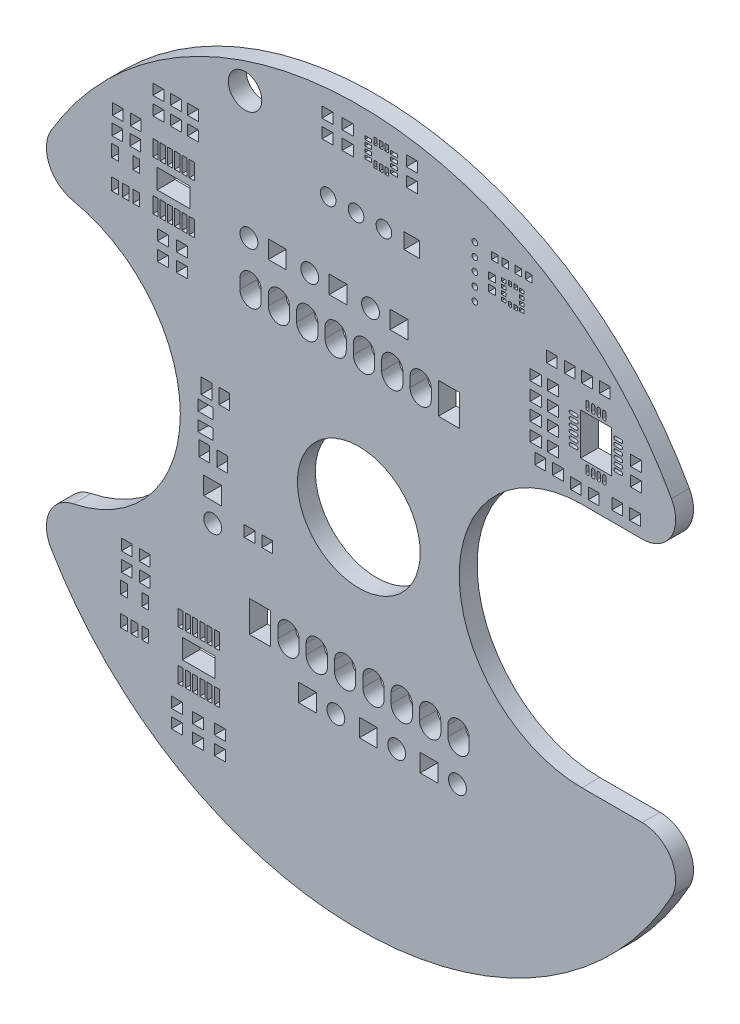
from build123d import *

# Parameters (mm, degrees)
MODEL_R            = 0.254
MODEL_R_2          = 1.5
MODEL_R_3          = 0.7
MODEL_R_4          = 0.8
MODEL_R_5          = 5.5
MODEL_W            = 0.4
MODEL_H            = 0.3
MODEL_W_2          = 0.3
MODEL_H_2          = 0.4
MODEL_W_3          = 0.59
MODEL_H_3          = 0.64
MODEL_W_4          = 0.64
MODEL_H_4          = 0.59
MODEL_W_5          = 0.95
MODEL_H_5          = 1.35
MODEL_W_6          = 1.35
MODEL_H_6          = 0.95
MODEL_W_7          = 0.6
MODEL_H_7          = 1.1
MODEL_W_8          = 0.45
MODEL_H_8          = 1.425
MODEL_W_9          = 2.947
MODEL_H_9          = 1.753
MODEL_W_10         = 1.905
MODEL_H_10         = 2.794
MODEL_H_11         = 0.6
MODEL_W_11         = 2.75
MODEL_H_12         = 3.75
MODEL_H_13         = 1
MODEL_W_12         = 1
MODEL_W_13         = 1.4
MODEL_H_14         = 1.4
MODEL_W_14         = 1.6
MODEL_H_15         = 1.6
BOSS_EXTRU_1_DEPTH = 1.6


with BuildPart() as part:
    # Model → Boss.-Extru.1 (new body)
    with BuildSketch(Plane.XY):
        with BuildLine():
            Line((25.396899903, -10.999993012), (19.999999903, -10.999993012))
            ThreePointArc((19.999999903, -10.999993012), (8.999999903, 6.988e-06), (19.999999903, 11.000006988))
            Line((19.999999903, 11.000006988), (25.396899903, 11.000006988))
            ThreePointArc((25.396899903, 11.000006988), (27.97996517, 12.474395332), (28.024096726, 15.448298418))
            ThreePointArc((28.024096726, 15.448298418), (0.442472559, 31.996936135), (-27.5862, 16.2173))
            ThreePointArc((-27.5862, 16.2173), (-27.740535183, 13.476382519), (-25.6, 11.7575))
            ThreePointArc((-25.6, 11.7575), (-15.999807577, -5e-05), (-25.6, -11.7576))
            ThreePointArc((-25.6, -11.7576), (-27.740471547, -13.476449402), (-27.5862, -16.2173))
            ThreePointArc((-27.5862, -16.2173), (0.442475694, -31.996932561), (28.024099903, -15.448293012))
            ThreePointArc((28.024099903, -15.448293012), (27.979973551, -12.474382167), (25.396899903, -10.999993012))
        make_face()
        with Locations((10.4, 21.95)):
            Circle(MODEL_R, mode=Mode.SUBTRACT)
        with Locations((10.4, 23.1)):
            Circle(MODEL_R, mode=Mode.SUBTRACT)
        with Locations((10.4, 24.25)):
            Circle(MODEL_R, mode=Mode.SUBTRACT)
        with Locations((10.4, 25.4)):
            Circle(MODEL_R, mode=Mode.SUBTRACT)
        with Locations((10.4, 26.55)):
            Circle(MODEL_R, mode=Mode.SUBTRACT)
        with Locations((-10.2, 28)):
            Circle(MODEL_R_2, mode=Mode.SUBTRACT)
        with Locations((2.25, 23.5)):
            Circle(MODEL_R_3, mode=Mode.SUBTRACT)
        with Locations((-0.25, 23.5)):
            Circle(MODEL_R_3, mode=Mode.SUBTRACT)
        with Locations((-2.75, 23.5)):
            Circle(MODEL_R_3, mode=Mode.SUBTRACT)
        with Locations((-9.85, 16.75)):
            Circle(MODEL_R_4, mode=Mode.SUBTRACT)
        with Locations((-4.4, 16.75)):
            Circle(MODEL_R_4, mode=Mode.SUBTRACT)
        with Locations((1.05, 16.75)):
            Circle(MODEL_R_4, mode=Mode.SUBTRACT)
        with Locations((8.84, -16.3)):
            Circle(MODEL_R_4, mode=Mode.SUBTRACT)
        with Locations((3.39, -16.3)):
            Circle(MODEL_R_4, mode=Mode.SUBTRACT)
        with Locations((-2.06, -16.3)):
            Circle(MODEL_R_4, mode=Mode.SUBTRACT)
        with Locations((-13.1, -7.02)):
            Circle(MODEL_R_4, mode=Mode.SUBTRACT)
        with Locations((6.088e-06, 3.579e-06)):
            Circle(MODEL_R_5, mode=Mode.SUBTRACT)
        with Locations((14.6, 23.35)):
            Rectangle(MODEL_W, MODEL_H, mode=Mode.SUBTRACT)
        with Locations((14.6, 23.85)):
            Rectangle(MODEL_W, MODEL_H, mode=Mode.SUBTRACT)
        with Locations((14.6, 24.35)):
            Rectangle(MODEL_W, MODEL_H, mode=Mode.SUBTRACT)
        with Locations((14.6, 24.85)):
            Rectangle(MODEL_W, MODEL_H, mode=Mode.SUBTRACT)
        with Locations((14.05, 24.9)):
            Rectangle(MODEL_W_2, MODEL_H_2, mode=Mode.SUBTRACT)
        with Locations((13.55, 24.9)):
            Rectangle(MODEL_W_2, MODEL_H_2, mode=Mode.SUBTRACT)
        with Locations((13, 24.85)):
            Rectangle(MODEL_W, MODEL_H, mode=Mode.SUBTRACT)
        with Locations((13, 24.35)):
            Rectangle(MODEL_W, MODEL_H, mode=Mode.SUBTRACT)
        with Locations((13, 23.85)):
            Rectangle(MODEL_W, MODEL_H, mode=Mode.SUBTRACT)
        with Locations((13, 23.35)):
            Rectangle(MODEL_W, MODEL_H, mode=Mode.SUBTRACT)
        with Locations((13.55, 23.3)):
            Rectangle(MODEL_W_2, MODEL_H_2, mode=Mode.SUBTRACT)
        with Locations((14.05, 23.3)):
            Rectangle(MODEL_W_2, MODEL_H_2, mode=Mode.SUBTRACT)
        with Locations((14.27, 26.25)):
            Rectangle(MODEL_W_3, MODEL_H_3, mode=Mode.SUBTRACT)
        with Locations((15.23, 26.25)):
            Rectangle(MODEL_W_3, MODEL_H_3, mode=Mode.SUBTRACT)
        with Locations((13.13, 26.25)):
            Rectangle(MODEL_W_3, MODEL_H_3, mode=Mode.SUBTRACT)
        with Locations((12.17, 26.25)):
            Rectangle(MODEL_W_3, MODEL_H_3, mode=Mode.SUBTRACT)
        with Locations((11.95, 24.58)):
            Rectangle(MODEL_W_4, MODEL_H_4, mode=Mode.SUBTRACT)
        with Locations((11.95, 23.62)):
            Rectangle(MODEL_W_4, MODEL_H_4, mode=Mode.SUBTRACT)
        with Locations((-12.25, -1.8)):
            Rectangle(MODEL_W_5, MODEL_H_5, mode=Mode.SUBTRACT)
        with Locations((-13.85, -1.8)):
            Rectangle(MODEL_W_5, MODEL_H_5, mode=Mode.SUBTRACT)
        with Locations((-12.05, 3.15)):
            Rectangle(MODEL_W_5, MODEL_H_5, mode=Mode.SUBTRACT)
        with Locations((-13.65, 3.15)):
            Rectangle(MODEL_W_5, MODEL_H_5, mode=Mode.SUBTRACT)
        with Locations((-13.75, -0.1)):
            Rectangle(MODEL_W_6, MODEL_H_6, mode=Mode.SUBTRACT)
        with Locations((-13.75, 1.5)):
            Rectangle(MODEL_W_6, MODEL_H_6, mode=Mode.SUBTRACT)
        with Locations((-21.85, 14.8)):
            Rectangle(MODEL_W_7, MODEL_H_7, mode=Mode.SUBTRACT)
        with Locations((-20.9, 14.8)):
            Rectangle(MODEL_W_7, MODEL_H_7, mode=Mode.SUBTRACT)
        with Locations((-19.95, 14.8)):
            Rectangle(MODEL_W_7, MODEL_H_7, mode=Mode.SUBTRACT)
        with Locations((-19.95, 17.4)):
            Rectangle(MODEL_W_7, MODEL_H_7, mode=Mode.SUBTRACT)
        with Locations((-21.85, 17.4)):
            Rectangle(MODEL_W_7, MODEL_H_7, mode=Mode.SUBTRACT)
        with Locations((-21.05, -18.7)):
            Rectangle(MODEL_W_7, MODEL_H_7, mode=Mode.SUBTRACT)
        with Locations((-20.1, -18.7)):
            Rectangle(MODEL_W_7, MODEL_H_7, mode=Mode.SUBTRACT)
        with Locations((-19.15, -18.7)):
            Rectangle(MODEL_W_7, MODEL_H_7, mode=Mode.SUBTRACT)
        with Locations((-19.15, -16.1)):
            Rectangle(MODEL_W_7, MODEL_H_7, mode=Mode.SUBTRACT)
        with Locations((-21.05, -16.1)):
            Rectangle(MODEL_W_7, MODEL_H_7, mode=Mode.SUBTRACT)
        with Locations((-18.225, 15.038)):
            Rectangle(MODEL_W_8, MODEL_H_8, mode=Mode.SUBTRACT)
        with Locations((-17.575, 15.038)):
            Rectangle(MODEL_W_8, MODEL_H_8, mode=Mode.SUBTRACT)
        with Locations((-16.925, 15.038)):
            Rectangle(MODEL_W_8, MODEL_H_8, mode=Mode.SUBTRACT)
        with Locations((-16.275, 15.038)):
            Rectangle(MODEL_W_8, MODEL_H_8, mode=Mode.SUBTRACT)
        with Locations((-15.625, 15.038)):
            Rectangle(MODEL_W_8, MODEL_H_8, mode=Mode.SUBTRACT)
        with Locations((-14.975, 15.038)):
            Rectangle(MODEL_W_8, MODEL_H_8, mode=Mode.SUBTRACT)
        with Locations((-14.975, 19.462)):
            Rectangle(MODEL_W_8, MODEL_H_8, mode=Mode.SUBTRACT)
        with Locations((-15.625, 19.462)):
            Rectangle(MODEL_W_8, MODEL_H_8, mode=Mode.SUBTRACT)
        with Locations((-16.275, 19.462)):
            Rectangle(MODEL_W_8, MODEL_H_8, mode=Mode.SUBTRACT)
        with Locations((-16.925, 19.462)):
            Rectangle(MODEL_W_8, MODEL_H_8, mode=Mode.SUBTRACT)
        with Locations((-17.575, 19.462)):
            Rectangle(MODEL_W_8, MODEL_H_8, mode=Mode.SUBTRACT)
        with Locations((-18.225, 19.462)):
            Rectangle(MODEL_W_8, MODEL_H_8, mode=Mode.SUBTRACT)
        with Locations((-16.6, 17.25)):
            Rectangle(MODEL_W_9, MODEL_H_9, mode=Mode.SUBTRACT)
        with Locations((-12.725, -15.888)):
            Rectangle(MODEL_W_8, MODEL_H_8, mode=Mode.SUBTRACT)
        with Locations((-13.375, -15.888)):
            Rectangle(MODEL_W_8, MODEL_H_8, mode=Mode.SUBTRACT)
        with Locations((-14.025, -15.888)):
            Rectangle(MODEL_W_8, MODEL_H_8, mode=Mode.SUBTRACT)
        with Locations((-14.675, -15.888)):
            Rectangle(MODEL_W_8, MODEL_H_8, mode=Mode.SUBTRACT)
        with Locations((-15.325, -15.888)):
            Rectangle(MODEL_W_8, MODEL_H_8, mode=Mode.SUBTRACT)
        with Locations((-15.975, -15.888)):
            Rectangle(MODEL_W_8, MODEL_H_8, mode=Mode.SUBTRACT)
        with Locations((-15.975, -20.312)):
            Rectangle(MODEL_W_8, MODEL_H_8, mode=Mode.SUBTRACT)
        with Locations((-15.325, -20.312)):
            Rectangle(MODEL_W_8, MODEL_H_8, mode=Mode.SUBTRACT)
        with Locations((-14.675, -20.312)):
            Rectangle(MODEL_W_8, MODEL_H_8, mode=Mode.SUBTRACT)
        with Locations((-14.025, -20.312)):
            Rectangle(MODEL_W_8, MODEL_H_8, mode=Mode.SUBTRACT)
        with Locations((-13.375, -20.312)):
            Rectangle(MODEL_W_8, MODEL_H_8, mode=Mode.SUBTRACT)
        with Locations((-12.725, -20.312)):
            Rectangle(MODEL_W_8, MODEL_H_8, mode=Mode.SUBTRACT)
        with Locations((-14.35, -18.1)):
            Rectangle(MODEL_W_9, MODEL_H_9, mode=Mode.SUBTRACT)
        with Locations((8.08, 12.8)):
            Rectangle(MODEL_W_10, MODEL_H_10, mode=Mode.SUBTRACT)
        with BuildLine():
            Line((4.5875, 12.3555), (4.5875, 13.2445))
            ThreePointArc((4.5875, 13.2445), (5.54, 14.197), (6.4925, 13.2445))
            Line((6.4925, 13.2445), (6.4925, 12.3555))
            ThreePointArc((6.4925, 12.3555), (5.54, 11.403), (4.5875, 12.3555))
        make_face(mode=Mode.SUBTRACT)
        with BuildLine():
            Line((2.0475, 12.3555), (2.0475, 13.2445))
            ThreePointArc((2.0475, 13.2445), (3, 14.197), (3.9525, 13.2445))
            Line((3.9525, 13.2445), (3.9525, 12.3555))
            ThreePointArc((3.9525, 12.3555), (3, 11.403), (2.0475, 12.3555))
        make_face(mode=Mode.SUBTRACT)
        with BuildLine():
            Line((-0.4925, 12.3555), (-0.4925, 13.2445))
            ThreePointArc((-0.4925, 13.2445), (0.46, 14.197), (1.4125, 13.2445))
            Line((1.4125, 13.2445), (1.4125, 12.3555))
            ThreePointArc((1.4125, 12.3555), (0.46, 11.403), (-0.4925, 12.3555))
        make_face(mode=Mode.SUBTRACT)
        with BuildLine():
            Line((-3.0325, 12.3555), (-3.0325, 13.2445))
            ThreePointArc((-3.0325, 13.2445), (-2.08, 14.197), (-1.1275, 13.2445))
            Line((-1.1275, 13.2445), (-1.1275, 12.3555))
            ThreePointArc((-1.1275, 12.3555), (-2.08, 11.403), (-3.0325, 12.3555))
        make_face(mode=Mode.SUBTRACT)
        with BuildLine():
            Line((-5.5725, 12.3555), (-5.5725, 13.2445))
            ThreePointArc((-5.5725, 13.2445), (-4.62, 14.197), (-3.6675, 13.2445))
            Line((-3.6675, 13.2445), (-3.6675, 12.3555))
            ThreePointArc((-3.6675, 12.3555), (-4.62, 11.403), (-5.5725, 12.3555))
        make_face(mode=Mode.SUBTRACT)
        with BuildLine():
            Line((-8.1125, 12.3555), (-8.1125, 13.2445))
            ThreePointArc((-8.1125, 13.2445), (-7.16, 14.197), (-6.2075, 13.2445))
            Line((-6.2075, 13.2445), (-6.2075, 12.3555))
            ThreePointArc((-6.2075, 12.3555), (-7.16, 11.403), (-8.1125, 12.3555))
        make_face(mode=Mode.SUBTRACT)
        with BuildLine():
            Line((-10.6525, 12.3555), (-10.6525, 13.2445))
            ThreePointArc((-10.6525, 13.2445), (-9.7, 14.197), (-8.7475, 13.2445))
            Line((-8.7475, 13.2445), (-8.7475, 12.3555))
            ThreePointArc((-8.7475, 12.3555), (-9.7, 11.403), (-10.6525, 12.3555))
        make_face(mode=Mode.SUBTRACT)
        with Locations((-8.85, -12.6)):
            Rectangle(MODEL_W_10, MODEL_H_10, mode=Mode.SUBTRACT)
        with BuildLine():
            Line((-5.3575, -12.1555), (-5.3575, -13.0445))
            ThreePointArc((-5.3575, -13.0445), (-6.31, -13.997), (-7.2625, -13.0445))
            Line((-7.2625, -13.0445), (-7.2625, -12.1555))
            ThreePointArc((-7.2625, -12.1555), (-6.31, -11.203), (-5.3575, -12.1555))
        make_face(mode=Mode.SUBTRACT)
        with BuildLine():
            Line((-2.8175, -12.1555), (-2.8175, -13.0445))
            ThreePointArc((-2.8175, -13.0445), (-3.77, -13.997), (-4.7225, -13.0445))
            Line((-4.7225, -13.0445), (-4.7225, -12.1555))
            ThreePointArc((-4.7225, -12.1555), (-3.77, -11.203), (-2.8175, -12.1555))
        make_face(mode=Mode.SUBTRACT)
        with BuildLine():
            Line((-0.2775, -12.1555), (-0.2775, -13.0445))
            ThreePointArc((-0.2775, -13.0445), (-1.23, -13.997), (-2.1825, -13.0445))
            Line((-2.1825, -13.0445), (-2.1825, -12.1555))
            ThreePointArc((-2.1825, -12.1555), (-1.23, -11.203), (-0.2775, -12.1555))
        make_face(mode=Mode.SUBTRACT)
        with BuildLine():
            Line((2.2625, -12.1555), (2.2625, -13.0445))
            ThreePointArc((2.2625, -13.0445), (1.31, -13.997), (0.3575, -13.0445))
            Line((0.3575, -13.0445), (0.3575, -12.1555))
            ThreePointArc((0.3575, -12.1555), (1.31, -11.203), (2.2625, -12.1555))
        make_face(mode=Mode.SUBTRACT)
        with BuildLine():
            Line((4.8025, -12.1555), (4.8025, -13.0445))
            ThreePointArc((4.8025, -13.0445), (3.85, -13.997), (2.8975, -13.0445))
            Line((2.8975, -13.0445), (2.8975, -12.1555))
            ThreePointArc((2.8975, -12.1555), (3.85, -11.203), (4.8025, -12.1555))
        make_face(mode=Mode.SUBTRACT)
        with BuildLine():
            Line((7.3425, -12.1555), (7.3425, -13.0445))
            ThreePointArc((7.3425, -13.0445), (6.39, -13.997), (5.4375, -13.0445))
            Line((5.4375, -13.0445), (5.4375, -12.1555))
            ThreePointArc((5.4375, -12.1555), (6.39, -11.203), (7.3425, -12.1555))
        make_face(mode=Mode.SUBTRACT)
        with BuildLine():
            Line((9.8825, -12.1555), (9.8825, -13.0445))
            ThreePointArc((9.8825, -13.0445), (8.93, -13.997), (7.9775, -13.0445))
            Line((7.9775, -13.0445), (7.9775, -12.1555))
            ThreePointArc((7.9775, -12.1555), (8.93, -11.203), (9.8825, -12.1555))
        make_face(mode=Mode.SUBTRACT)
        with Locations((3.15, 28.25)):
            Rectangle(MODEL_W_7, MODEL_H, mode=Mode.SUBTRACT)
        with Locations((3.15, 28.75)):
            Rectangle(MODEL_W_7, MODEL_H, mode=Mode.SUBTRACT)
        with Locations((3.15, 29.25)):
            Rectangle(MODEL_W_7, MODEL_H, mode=Mode.SUBTRACT)
        with Locations((3.15, 29.75)):
            Rectangle(MODEL_W_7, MODEL_H, mode=Mode.SUBTRACT)
        with Locations((2.5, 29.9)):
            Rectangle(MODEL_W_2, MODEL_H_11, mode=Mode.SUBTRACT)
        with Locations((2, 29.9)):
            Rectangle(MODEL_W_2, MODEL_H_11, mode=Mode.SUBTRACT)
        with Locations((1.5, 29.9)):
            Rectangle(MODEL_W_2, MODEL_H_11, mode=Mode.SUBTRACT)
        with Locations((0.85, 29.75)):
            Rectangle(MODEL_W_7, MODEL_H, mode=Mode.SUBTRACT)
        with Locations((0.85, 29.25)):
            Rectangle(MODEL_W_7, MODEL_H, mode=Mode.SUBTRACT)
        with Locations((0.85, 28.75)):
            Rectangle(MODEL_W_7, MODEL_H, mode=Mode.SUBTRACT)
        with Locations((0.85, 28.25)):
            Rectangle(MODEL_W_7, MODEL_H, mode=Mode.SUBTRACT)
        with Locations((1.5, 28.1)):
            Rectangle(MODEL_W_2, MODEL_H_11, mode=Mode.SUBTRACT)
        with Locations((2, 28.1)):
            Rectangle(MODEL_W_2, MODEL_H_11, mode=Mode.SUBTRACT)
        with Locations((2.5, 28.1)):
            Rectangle(MODEL_W_2, MODEL_H_11, mode=Mode.SUBTRACT)
        with BuildLine():
            Line((23, 15.3), (23.5, 15.3))
            ThreePointArc((23.5, 15.3), (23.65, 15.15), (23.5, 15))
            Line((23.5, 15), (23, 15))
            ThreePointArc((23, 15), (22.85, 15.15), (23, 15.3))
        make_face(mode=Mode.SUBTRACT)
        with BuildLine():
            Line((23, 15.8), (23.5, 15.8))
            ThreePointArc((23.5, 15.8), (23.65, 15.65), (23.5, 15.5))
            Line((23.5, 15.5), (23, 15.5))
            ThreePointArc((23, 15.5), (22.85, 15.65), (23, 15.8))
        make_face(mode=Mode.SUBTRACT)
        with BuildLine():
            Line((23, 16.3), (23.5, 16.3))
            ThreePointArc((23.5, 16.3), (23.65, 16.15), (23.5, 16))
            Line((23.5, 16), (23, 16))
            ThreePointArc((23, 16), (22.85, 16.15), (23, 16.3))
        make_face(mode=Mode.SUBTRACT)
        with BuildLine():
            Line((23, 16.8), (23.5, 16.8))
            ThreePointArc((23.5, 16.8), (23.65, 16.65), (23.5, 16.5))
            Line((23.5, 16.5), (23, 16.5))
            ThreePointArc((23, 16.5), (22.85, 16.65), (23, 16.8))
        make_face(mode=Mode.SUBTRACT)
        with BuildLine():
            Line((23, 17.3), (23.5, 17.3))
            ThreePointArc((23.5, 17.3), (23.65, 17.15), (23.5, 17))
            Line((23.5, 17), (23, 17))
            ThreePointArc((23, 17), (22.85, 17.15), (23, 17.3))
        make_face(mode=Mode.SUBTRACT)
        with BuildLine():
            Line((23, 17.8), (23.5, 17.8))
            ThreePointArc((23.5, 17.8), (23.65, 17.65), (23.5, 17.5))
            Line((23.5, 17.5), (23, 17.5))
            ThreePointArc((23, 17.5), (22.85, 17.65), (23, 17.8))
        make_face(mode=Mode.SUBTRACT)
        with BuildLine():
            Line((21.85, 18.65), (21.85, 19.15))
            ThreePointArc((21.85, 19.15), (22, 19.3), (22.15, 19.15))
            Line((22.15, 19.15), (22.15, 18.65))
            ThreePointArc((22.15, 18.65), (22, 18.5), (21.85, 18.65))
        make_face(mode=Mode.SUBTRACT)
        with BuildLine():
            Line((21.35, 18.65), (21.35, 19.15))
            ThreePointArc((21.35, 19.15), (21.5, 19.3), (21.65, 19.15))
            Line((21.65, 19.15), (21.65, 18.65))
            ThreePointArc((21.65, 18.65), (21.5, 18.5), (21.35, 18.65))
        make_face(mode=Mode.SUBTRACT)
        with BuildLine():
            Line((20.85, 18.65), (20.85, 19.15))
            ThreePointArc((20.85, 19.15), (21, 19.3), (21.15, 19.15))
            Line((21.15, 19.15), (21.15, 18.65))
            ThreePointArc((21.15, 18.65), (21, 18.5), (20.85, 18.65))
        make_face(mode=Mode.SUBTRACT)
        with BuildLine():
            Line((20.35, 18.65), (20.35, 19.15))
            ThreePointArc((20.35, 19.15), (20.5, 19.3), (20.65, 19.15))
            Line((20.65, 19.15), (20.65, 18.65))
            ThreePointArc((20.65, 18.65), (20.5, 18.5), (20.35, 18.65))
        make_face(mode=Mode.SUBTRACT)
        with BuildLine():
            Line((19, 17.8), (19.5, 17.8))
            ThreePointArc((19.5, 17.8), (19.65, 17.65), (19.5, 17.5))
            Line((19.5, 17.5), (19, 17.5))
            ThreePointArc((19, 17.5), (18.85, 17.65), (19, 17.8))
        make_face(mode=Mode.SUBTRACT)
        with BuildLine():
            Line((19, 17.3), (19.5, 17.3))
            ThreePointArc((19.5, 17.3), (19.65, 17.15), (19.5, 17))
            Line((19.5, 17), (19, 17))
            ThreePointArc((19, 17), (18.85, 17.15), (19, 17.3))
        make_face(mode=Mode.SUBTRACT)
        with BuildLine():
            Line((19, 16.8), (19.5, 16.8))
            ThreePointArc((19.5, 16.8), (19.65, 16.65), (19.5, 16.5))
            Line((19.5, 16.5), (19, 16.5))
            ThreePointArc((19, 16.5), (18.85, 16.65), (19, 16.8))
        make_face(mode=Mode.SUBTRACT)
        with BuildLine():
            Line((19, 16.3), (19.5, 16.3))
            ThreePointArc((19.5, 16.3), (19.65, 16.15), (19.5, 16))
            Line((19.5, 16), (19, 16))
            ThreePointArc((19, 16), (18.85, 16.15), (19, 16.3))
        make_face(mode=Mode.SUBTRACT)
        with BuildLine():
            Line((19, 15.8), (19.5, 15.8))
            ThreePointArc((19.5, 15.8), (19.65, 15.65), (19.5, 15.5))
            Line((19.5, 15.5), (19, 15.5))
            ThreePointArc((19, 15.5), (18.85, 15.65), (19, 15.8))
        make_face(mode=Mode.SUBTRACT)
        with BuildLine():
            Line((19, 15.3), (19.5, 15.3))
            ThreePointArc((19.5, 15.3), (19.65, 15.15), (19.5, 15))
            Line((19.5, 15), (19, 15))
            ThreePointArc((19, 15), (18.85, 15.15), (19, 15.3))
        make_face(mode=Mode.SUBTRACT)
        with BuildLine():
            Line((20.35, 13.65), (20.35, 14.15))
            ThreePointArc((20.35, 14.15), (20.5, 14.3), (20.65, 14.15))
            Line((20.65, 14.15), (20.65, 13.65))
            ThreePointArc((20.65, 13.65), (20.5, 13.5), (20.35, 13.65))
        make_face(mode=Mode.SUBTRACT)
        with BuildLine():
            Line((20.85, 13.65), (20.85, 14.15))
            ThreePointArc((20.85, 14.15), (21, 14.3), (21.15, 14.15))
            Line((21.15, 14.15), (21.15, 13.65))
            ThreePointArc((21.15, 13.65), (21, 13.5), (20.85, 13.65))
        make_face(mode=Mode.SUBTRACT)
        with BuildLine():
            Line((21.35, 13.65), (21.35, 14.15))
            ThreePointArc((21.35, 14.15), (21.5, 14.3), (21.65, 14.15))
            Line((21.65, 14.15), (21.65, 13.65))
            ThreePointArc((21.65, 13.65), (21.5, 13.5), (21.35, 13.65))
        make_face(mode=Mode.SUBTRACT)
        with BuildLine():
            Line((21.85, 13.65), (21.85, 14.15))
            ThreePointArc((21.85, 14.15), (22, 14.3), (22.15, 14.15))
            Line((22.15, 14.15), (22.15, 13.65))
            ThreePointArc((22.15, 13.65), (22, 13.5), (21.85, 13.65))
        make_face(mode=Mode.SUBTRACT)
        with Locations((21.25, 16.4)):
            Rectangle(MODEL_W_11, MODEL_H_12, mode=Mode.SUBTRACT)
        with Locations((-9.8, -6.2)):
            Rectangle(MODEL_W_5, MODEL_H_13, mode=Mode.SUBTRACT)
        with Locations((-8.2, -6.2)):
            Rectangle(MODEL_W_5, MODEL_H_13, mode=Mode.SUBTRACT)
        with Locations((-21.6, 20.65)):
            Rectangle(MODEL_W_5, MODEL_H_13, mode=Mode.SUBTRACT)
        with Locations((-20, 20.65)):
            Rectangle(MODEL_W_5, MODEL_H_13, mode=Mode.SUBTRACT)
        with Locations((-20.8, -12.75)):
            Rectangle(MODEL_W_5, MODEL_H_13, mode=Mode.SUBTRACT)
        with Locations((-19.2, -12.75)):
            Rectangle(MODEL_W_5, MODEL_H_13, mode=Mode.SUBTRACT)
        with Locations((-21.65, 19.05)):
            Rectangle(MODEL_W_5, MODEL_H_13, mode=Mode.SUBTRACT)
        with Locations((-20.05, 19.05)):
            Rectangle(MODEL_W_5, MODEL_H_13, mode=Mode.SUBTRACT)
        with Locations((-20.8, -14.4)):
            Rectangle(MODEL_W_5, MODEL_H_13, mode=Mode.SUBTRACT)
        with Locations((-19.2, -14.4)):
            Rectangle(MODEL_W_5, MODEL_H_13, mode=Mode.SUBTRACT)
        with Locations((-17.95, 24)):
            Rectangle(MODEL_W_12, MODEL_H_6, mode=Mode.SUBTRACT)
        with Locations((-17.95, 22.4)):
            Rectangle(MODEL_W_12, MODEL_H_6, mode=Mode.SUBTRACT)
        with Locations((20.45, 20.9)):
            Rectangle(MODEL_W_5, MODEL_H_13, mode=Mode.SUBTRACT)
        with Locations((22.05, 20.9)):
            Rectangle(MODEL_W_5, MODEL_H_13, mode=Mode.SUBTRACT)
        with Locations((-16.4, 22.4)):
            Rectangle(MODEL_W_12, MODEL_H_6, mode=Mode.SUBTRACT)
        with Locations((-16.4, 24)):
            Rectangle(MODEL_W_12, MODEL_H_6, mode=Mode.SUBTRACT)
        with Locations((-14.4, -23)):
            Rectangle(MODEL_W_12, MODEL_H_6, mode=Mode.SUBTRACT)
        with Locations((-14.4, -24.6)):
            Rectangle(MODEL_W_12, MODEL_H_6, mode=Mode.SUBTRACT)
        with Locations((-17.55, 12.9)):
            Rectangle(MODEL_W_12, MODEL_H_6, mode=Mode.SUBTRACT)
        with Locations((-17.55, 11.3)):
            Rectangle(MODEL_W_12, MODEL_H_6, mode=Mode.SUBTRACT)
        with Locations((-15.85, 11.3)):
            Rectangle(MODEL_W_12, MODEL_H_6, mode=Mode.SUBTRACT)
        with Locations((-15.85, 12.9)):
            Rectangle(MODEL_W_12, MODEL_H_6, mode=Mode.SUBTRACT)
        with Locations((-14.85, 24)):
            Rectangle(MODEL_W_12, MODEL_H_6, mode=Mode.SUBTRACT)
        with Locations((-14.85, 22.4)):
            Rectangle(MODEL_W_12, MODEL_H_6, mode=Mode.SUBTRACT)
        with Locations((4.75, 29.8)):
            Rectangle(MODEL_W_12, MODEL_H_6, mode=Mode.SUBTRACT)
        with Locations((4.75, 28.2)):
            Rectangle(MODEL_W_12, MODEL_H_6, mode=Mode.SUBTRACT)
        with Locations((-2.8, 28.2)):
            Rectangle(MODEL_W_12, MODEL_H_6, mode=Mode.SUBTRACT)
        with Locations((-2.8, 29.8)):
            Rectangle(MODEL_W_12, MODEL_H_6, mode=Mode.SUBTRACT)
        with Locations((-1, 28.2)):
            Rectangle(MODEL_W_12, MODEL_H_6, mode=Mode.SUBTRACT)
        with Locations((-1, 29.8)):
            Rectangle(MODEL_W_12, MODEL_H_6, mode=Mode.SUBTRACT)
        with Locations((16.25, 12.45)):
            Rectangle(MODEL_W_5, MODEL_H_13, mode=Mode.SUBTRACT)
        with Locations((17.85, 12.45)):
            Rectangle(MODEL_W_5, MODEL_H_13, mode=Mode.SUBTRACT)
        with Locations((19.45, 12.15)):
            Rectangle(MODEL_W_5, MODEL_H_13, mode=Mode.SUBTRACT)
        with Locations((21.05, 12.15)):
            Rectangle(MODEL_W_5, MODEL_H_13, mode=Mode.SUBTRACT)
        with Locations((17.3, 20.9)):
            Rectangle(MODEL_W_5, MODEL_H_13, mode=Mode.SUBTRACT)
        with Locations((18.9, 20.9)):
            Rectangle(MODEL_W_5, MODEL_H_13, mode=Mode.SUBTRACT)
        with Locations((24.85, 15)):
            Rectangle(MODEL_W_12, MODEL_H_6, mode=Mode.SUBTRACT)
        with Locations((24.85, 16.6)):
            Rectangle(MODEL_W_12, MODEL_H_6, mode=Mode.SUBTRACT)
        with Locations((24.75, 12.4)):
            Rectangle(MODEL_W_5, MODEL_H_13, mode=Mode.SUBTRACT)
        with Locations((23.15, 12.4)):
            Rectangle(MODEL_W_5, MODEL_H_13, mode=Mode.SUBTRACT)
        with Locations((15.85, 14)):
            Rectangle(MODEL_W_12, MODEL_H_6, mode=Mode.SUBTRACT)
        with Locations((15.85, 15.6)):
            Rectangle(MODEL_W_12, MODEL_H_6, mode=Mode.SUBTRACT)
        with Locations((17.4, 14)):
            Rectangle(MODEL_W_12, MODEL_H_6, mode=Mode.SUBTRACT)
        with Locations((17.4, 15.6)):
            Rectangle(MODEL_W_12, MODEL_H_6, mode=Mode.SUBTRACT)
        with Locations((15.85, 17.15)):
            Rectangle(MODEL_W_12, MODEL_H_6, mode=Mode.SUBTRACT)
        with Locations((15.85, 18.75)):
            Rectangle(MODEL_W_12, MODEL_H_6, mode=Mode.SUBTRACT)
        with Locations((17.4, 17.15)):
            Rectangle(MODEL_W_12, MODEL_H_6, mode=Mode.SUBTRACT)
        with Locations((17.4, 18.75)):
            Rectangle(MODEL_W_12, MODEL_H_6, mode=Mode.SUBTRACT)
        with Locations((-16.3, -22.75)):
            Rectangle(MODEL_W_12, MODEL_H_6, mode=Mode.SUBTRACT)
        with Locations((-16.3, -24.35)):
            Rectangle(MODEL_W_12, MODEL_H_6, mode=Mode.SUBTRACT)
        with Locations((-12.45, -24.5)):
            Rectangle(MODEL_W_12, MODEL_H_6, mode=Mode.SUBTRACT)
        with Locations((-12.45, -22.9)):
            Rectangle(MODEL_W_12, MODEL_H_6, mode=Mode.SUBTRACT)
        with Locations((4.75, 23.5)):
            Rectangle(MODEL_W_13, MODEL_H_14, mode=Mode.SUBTRACT)
        with Locations((-7.31, 16.75)):
            Rectangle(MODEL_W_14, MODEL_H_15, mode=Mode.SUBTRACT)
        with Locations((-1.86, 16.75)):
            Rectangle(MODEL_W_14, MODEL_H_15, mode=Mode.SUBTRACT)
        with Locations((3.59, 16.75)):
            Rectangle(MODEL_W_14, MODEL_H_15, mode=Mode.SUBTRACT)
        with Locations((6.3, -16.3)):
            Rectangle(MODEL_W_14, MODEL_H_15, mode=Mode.SUBTRACT)
        with Locations((0.85, -16.3)):
            Rectangle(MODEL_W_14, MODEL_H_15, mode=Mode.SUBTRACT)
        with Locations((-4.6, -16.3)):
            Rectangle(MODEL_W_14, MODEL_H_15, mode=Mode.SUBTRACT)
        with Locations((-13.1, -4.48)):
            Rectangle(MODEL_W_14, MODEL_H_15, mode=Mode.SUBTRACT)
    extrude(amount=BOSS_EXTRU_1_DEPTH)


solid = part.part
